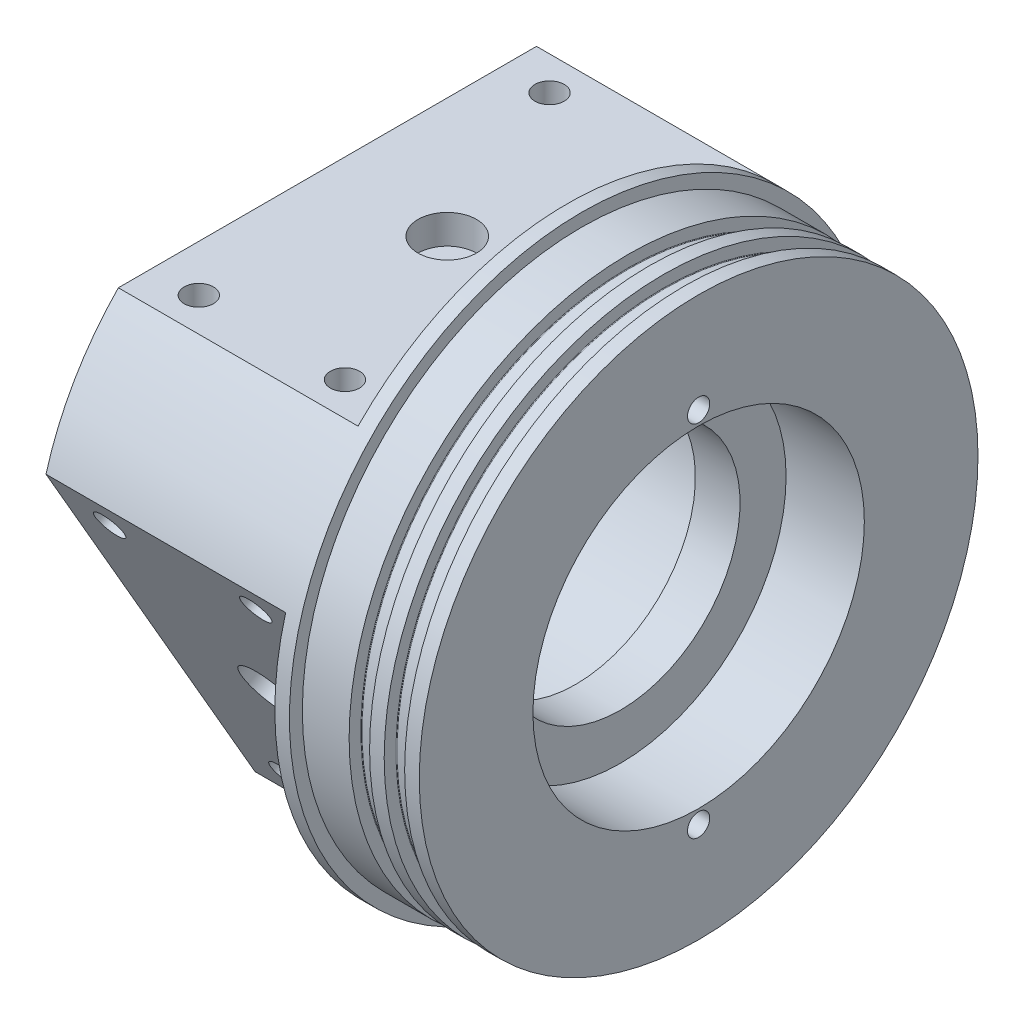
from build123d import *

# Parameters (mm, degrees)
CUT_EXTRUDE2_DEPTH               = 19.05
F_6_32_TAPPED_HOLE2_AT_2_COUNT   = 2
F_6_32_TAPPED_HOLE2_AT_2_PITCH   = 48.360159222
F_6_32_TAPPED_HOLE2_AT_3_COUNT   = 2
F_6_32_TAPPED_HOLE2_AT_3_PITCH   = 44.45
F_6_32_TAPPED_HOLE2_AT_4_COUNT   = 2
F_6_32_TAPPED_HOLE2_AT_4_PITCH   = 19.05
CIRPATTERN4_COUNT                = 3
FILLET1_R                        = 0.127
SKETCH26_R                       = 60.6933
CUT_EXTRUDE8_DEPTH               = 15.24
FILLET2_R                        = 3.175
FILLET3_R                        = 3.175
FILLET4_R                        = 3.175
SKETCH37_R                       = 36
CUT_EXTRUDE11_DEPTH              = 17
CUT_EXTRUDE12_REACH              = 122.275
SKETCH38_R                       = 26
CUT_EXTRUDE13_START              = -53.31
SKETCH39_R                       = 36
CUT_EXTRUDE13_DEPTH              = 53.31
BOSS_EXTRUDE1_DEPTH              = 0.635
BOSS_EXTRUDE1_DEPTH_BACK         = 51.435
SKETCH53_R                       = 63.5
SKETCH53_R_2                     = 36
CUT_EXTRUDE17_DEPTH              = 52.07
SKETCH55_R                       = 6.35
CUT_EXTRUDE18_DEPTH              = 6.35
F_1_4_20_TAPPED_HOLE2_AT_2_COUNT = 2
F_1_4_20_TAPPED_HOLE2_AT_2_PITCH = 31.75
F_1_4_20_TAPPED_HOLE2_AT_3_COUNT = 2
F_1_4_20_TAPPED_HOLE2_AT_3_PITCH = 82.55
F_1_4_20_TAPPED_HOLE2_AT_4_COUNT = 2
F_1_4_20_TAPPED_HOLE2_AT_4_PITCH = 76.2
CIRPATTERN6_COUNT                = 3
CHAMFER1_SIZE                    = 1.27
CHAMFER1_SIZE2                   = 0.733234842
F_10_24_TAPPED_HOLE1_D           = 3.7973
F_10_24_TAPPED_HOLE1_DEPTH       = 12.7
F_10_24_TAPPED_HOLE1_CBORE_D     = 4.826
F_10_24_TAPPED_HOLE1_CBORE_DEPTH = 9.652
F_10_24_TAPPED_HOLE1_TIP         = 1.140824014


with BuildPart() as part:
    # Sketch4 → Revolve1 (revolve)
    with BuildSketch(Plane.XY, mode=Mode.PRIVATE) as revolve1_sk:
        Polygon((0, 0), (0, 63.5), (22.225, 63.5), (22.225, 60.6933), (32.385, 60.6933), (32.385, 58.0136), (36.83, 58.0136), (36.83, 60.6933), (40.005, 60.6933), (40.005, 58.0136), (44.45, 58.0136), (44.45, 60.6933), (47.625, 60.6933), (47.625, 0), align=None)
    revolve(revolve1_sk.sketch.rotate(Axis((0, 0, 0), (1, 0, 0)), 180), axis=Axis((0, 0, 0), (1, 0, 0)))

    # Mirror2: part across plane


with BuildPart() as part_1:
    add(part.part)
    add(part.part.mirror(Plane(origin=(0, 0, 0), x_dir=(0, 0, 1), z_dir=(1, 0, 0))))

    # Sketch8 → Cut-Extrude2 (cut, symmetric)
    with BuildSketch(Plane(origin=(0, 0, 0), x_dir=(0, 0, -1), z_dir=(1, 0, 0))):
        with BuildLine():
            Line((-31.75, 48.64261314), (31.75, 48.64261314))
            Line((31.75, 48.64261314), (31.75, 54.99261314))
            ThreePointArc((31.75, 54.99261314), (0, 63.5), (-31.75, 54.99261314))
            Line((-31.75, 54.99261314), (-31.75, 48.64261314))
        make_face()
    cut_extrude2 = extrude(amount=CUT_EXTRUDE2_DEPTH, both=True, mode=Mode.SUBTRACT)

    # Sketch33 → #6-32 Tapped Hole2 (revolve, cut)
    with BuildSketch(Plane(origin=(-9.525, 48.64261314, -22.225), x_dir=(0, 0, 1), z_dir=(1, 0, 0))):
        Polygon((0, 0), (0, 8.81269403), (1.35255, 8), (1.35255, 5.588), (1.7526, 5.588), (1.7526, 0), align=None)
    f_6_32_tapped_hole2 = revolve(axis=Axis((-9.525, 54.99261314, -22.225), (0, -1, 0)), mode=Mode.SUBTRACT)

    # #6-32 Tapped Hole2 at 2: #6-32 Tapped Hole2 ×2
    with Locations(*[Vector(0.3939192985791678, 0, 0.9191450300180579) * (i * F_6_32_TAPPED_HOLE2_AT_2_PITCH) for i in range(1, F_6_32_TAPPED_HOLE2_AT_2_COUNT)]):
        add(f_6_32_tapped_hole2, mode=Mode.SUBTRACT)

    # #6-32 Tapped Hole2 at 3: #6-32 Tapped Hole2 ×2
    with Locations(*[(0, 0, i * F_6_32_TAPPED_HOLE2_AT_3_PITCH) for i in range(1, F_6_32_TAPPED_HOLE2_AT_3_COUNT)]):
        add(f_6_32_tapped_hole2, mode=Mode.SUBTRACT)

    # #6-32 Tapped Hole2 at 4: #6-32 Tapped Hole2 ×2
    with Locations(*[(i * F_6_32_TAPPED_HOLE2_AT_4_PITCH, 0, 0) for i in range(1, F_6_32_TAPPED_HOLE2_AT_4_COUNT)]):
        add(f_6_32_tapped_hole2, mode=Mode.SUBTRACT)

    # CirPattern4: Cut-Extrude2, #6-32 Tapped Hole2 ×3 about axis
    cirpattern4_axis = Axis((0, 0, 0), (1, 0, 0))
    add([cut_extrude2.rotate(cirpattern4_axis, i * 360 / CIRPATTERN4_COUNT) for i in range(1, CIRPATTERN4_COUNT)], mode=Mode.SUBTRACT)
    add([f_6_32_tapped_hole2.rotate(cirpattern4_axis, i * 360 / CIRPATTERN4_COUNT) for i in range(1, CIRPATTERN4_COUNT)], mode=Mode.SUBTRACT)

    # CirPattern4 copy 1 sketch → CirPattern4 copy 1 (revolve, cut)
    with BuildSketch(Plane(origin=(9.525, -43.568721169, 31.013238686), x_dir=(0, -0.8660254037844386, -0.49999999999999994), z_dir=(1, 0, 0))):
        Polygon((0, 0), (0, 8.81269403), (1.35255, 8), (1.35255, 5.588), (1.7526, 5.588), (1.7526, 0), align=None)
    revolve(axis=Axis((9.525, -46.743721169, 36.5125), (0, 0.49999999999999994, -0.8660254037844386)), mode=Mode.SUBTRACT)

    # CirPattern4 copy 2 sketch → CirPattern4 copy 2 (revolve, cut)
    with BuildSketch(Plane(origin=(9.525, -5.073891971, -53.238238686), x_dir=(0, 0.8660254037844385, -0.5000000000000002), z_dir=(1, 0, 0))):
        Polygon((0, 0), (0, 8.81269403), (1.35255, 8), (1.35255, 5.588), (1.7526, 5.588), (1.7526, 0), align=None)
    revolve(axis=Axis((9.525, -8.248891971, -58.7375), (0, 0.5000000000000002, 0.8660254037844385)), mode=Mode.SUBTRACT)

    # CirPattern4 copy 3 sketch → CirPattern4 copy 3 (revolve, cut)
    with BuildSketch(Plane(origin=(-9.525, -43.568721169, 31.013238686), x_dir=(0, -0.8660254037844386, -0.49999999999999994), z_dir=(1, 0, 0))):
        Polygon((0, 0), (0, 8.81269403), (1.35255, 8), (1.35255, 5.588), (1.7526, 5.588), (1.7526, 0), align=None)
    revolve(axis=Axis((-9.525, -46.743721169, 36.5125), (0, 0.49999999999999994, -0.8660254037844386)), mode=Mode.SUBTRACT)

    # CirPattern4 copy 4 sketch → CirPattern4 copy 4 (revolve, cut)
    with BuildSketch(Plane(origin=(-9.525, -5.073891971, -53.238238686), x_dir=(0, 0.8660254037844385, -0.5000000000000002), z_dir=(1, 0, 0))):
        Polygon((0, 0), (0, 8.81269403), (1.35255, 8), (1.35255, 5.588), (1.7526, 5.588), (1.7526, 0), align=None)
    revolve(axis=Axis((-9.525, -8.248891971, -58.7375), (0, 0.5000000000000002, 0.8660254037844385)), mode=Mode.SUBTRACT)

    # CirPattern4 copy 5 sketch → CirPattern4 copy 5 (revolve, cut)
    with BuildSketch(Plane(origin=(9.525, -5.073891971, 53.238238686), x_dir=(0, -0.8660254037844386, -0.49999999999999994), z_dir=(1, 0, 0))):
        Polygon((0, 0), (0, 8.81269403), (1.35255, 8), (1.35255, 5.588), (1.7526, 5.588), (1.7526, 0), align=None)
    revolve(axis=Axis((9.525, -8.248891971, 58.7375), (0, 0.49999999999999994, -0.8660254037844386)), mode=Mode.SUBTRACT)

    # CirPattern4 copy 6 sketch → CirPattern4 copy 6 (revolve, cut)
    with BuildSketch(Plane(origin=(9.525, -43.568721169, -31.013238686), x_dir=(0, 0.8660254037844385, -0.5000000000000002), z_dir=(1, 0, 0))):
        Polygon((0, 0), (0, 8.81269403), (1.35255, 8), (1.35255, 5.588), (1.7526, 5.588), (1.7526, 0), align=None)
    revolve(axis=Axis((9.525, -46.743721169, -36.5125), (0, 0.5000000000000002, 0.8660254037844385)), mode=Mode.SUBTRACT)

    # Fillet1
    fillet1_edges = [part_1.edges().sort_by_distance(p)[0] for p in [
        (44.45, 58.0136, 0),
        (40.005, 58.0136, 0),
        (36.83, 58.0136, 0),
        (32.385, 58.0136, 0),
    ]]
    fillet(fillet1_edges, radius=FILLET1_R)

    # Sketch26 → Cut-Extrude8 (cut)
    with BuildSketch(Plane.ZY.offset(47.625)):
        with Locations(Location((0, 0, 0), (0, 0, 270))):
            Circle(SKETCH26_R)
    extrude(amount=-CUT_EXTRUDE8_DEPTH, mode=Mode.SUBTRACT)

    # Fillet2
    fillet2_edges = [part_1.edges().sort_by_distance(p)[0] for p in [
        (-19.05, 1.5875, 60.750369343),
    ]]
    fillet(fillet2_edges, radius=FILLET2_R)

    # Fillet3
    fillet3_edges = [part_1.edges().sort_by_distance(p)[0] for p in [
        (19.05, 1.5875, 60.750369343),
    ]]
    fillet(fillet3_edges, radius=FILLET3_R)

    # Fillet4
    fillet4_edges = [part_1.edges().sort_by_distance(p)[0] for p in [
        (-19.05, 1.5875, -60.750369343),
        (-19.05, -53.40511314, -29.000369343),
        (19.05, 1.5875, -60.750369343),
        (19.05, -53.40511314, -29.000369343),
        (-19.05, 51.81761314, 31.75),
        (-19.05, 51.81761314, -31.75),
        (19.05, 51.81761314, 31.75),
        (19.05, 51.81761314, -31.75),
        (-19.05, -53.40511314, 29.000369343),
        (19.05, -53.40511314, 29.000369343),
    ]]
    fillet(fillet4_edges, radius=FILLET4_R)

    # Sketch37 → Cut-Extrude11 (cut)
    with BuildSketch(Plane(origin=(47.625, 0, 0), x_dir=(0, 0, -1), z_dir=(1, 0, 0))):
        with Locations(Location((0, 0, 0), (0, 0, 90))):
            Circle(SKETCH37_R)
    extrude(amount=-CUT_EXTRUDE11_DEPTH, mode=Mode.SUBTRACT)

    # Sketch38 → Cut-Extrude12 (cut, up to next)
    with BuildSketch(Plane.ZY.offset(32.385), mode=Mode.PRIVATE) as cut_extrude12_sk1:
        with Locations(Location((0, 0, 0), (0, 0, 270))):
            Circle(SKETCH38_R)
    cut_extrude12_tool1 = extrude(cut_extrude12_sk1.sketch, amount=-CUT_EXTRUDE12_REACH, mode=Mode.PRIVATE) & part_1.part
    add(cut_extrude12_tool1.solids().sort_by_distance((-32.385, 0, 0))[0], mode=Mode.SUBTRACT)

    # Sketch39 → Cut-Extrude13 (cut)
    with BuildSketch(Plane.ZY.offset(32.385).offset(CUT_EXTRUDE13_START)):
        with Locations(Location((0, 0, 0), (0, 0, 90))):
            Circle(SKETCH39_R)
    extrude(amount=CUT_EXTRUDE13_DEPTH, mode=Mode.SUBTRACT)

    # Sketch53 → Boss-Extrude1 (add, two sides: drawn at the far end of the back side and taken through both)
    with BuildSketch(Plane.ZY.offset(32.385).offset(-BOSS_EXTRUDE1_DEPTH_BACK)):
        with Locations(Location((0, 0, 0), (0, 0, 270))):
            Circle(SKETCH53_R)
        with Locations(Location((0, 0, 0), (0, 0, 90))):
            Circle(SKETCH53_R_2, mode=Mode.SUBTRACT)
    extrude(amount=BOSS_EXTRUDE1_DEPTH + BOSS_EXTRUDE1_DEPTH_BACK)

    # Sketch54 → Cut-Extrude17 (cut)
    with BuildSketch(Plane.ZY.offset(33.02)):
        with BuildLine():
            Line((-45.422636136, 44.3738), (45.422636136, 44.3738))
            ThreePointArc((45.422636136, 44.3738), (0, 63.5), (-45.422636136, 44.3738))
        make_face()
    cut_extrude17 = extrude(amount=-CUT_EXTRUDE17_DEPTH, mode=Mode.SUBTRACT)

    # Sketch55 → Cut-Extrude18 (cut)
    with BuildSketch(Plane(origin=(0, 44.3738, 0), x_dir=(1, 0, 0), z_dir=(0, 1, 0))):
        with Locations(Location((-6.985, 0, 0), (0, 0, 180))):
            Circle(SKETCH55_R)
    cut_extrude18 = extrude(amount=-CUT_EXTRUDE18_DEPTH, mode=Mode.SUBTRACT)

    # Sketch60 → 1/4-20 Tapped Hole2 (revolve, cut)
    with BuildSketch(Plane(origin=(-22.86, 44.3738, -38.1), x_dir=(0, 0, 1), z_dir=(1, 0, 0))):
        Polygon((0, 0), (0, 20.583816902), (2.5527, 19.05), (2.5527, 12.7), (3.175, 12.7), (3.175, 0), align=None)
    f_1_4_20_tapped_hole2 = revolve(axis=Axis((-22.86, 50.7238, -38.1), (0, -1, 0)), mode=Mode.SUBTRACT)

    # 1/4-20 Tapped Hole2 at 2: 1/4-20 Tapped Hole2 ×2
    with Locations(*[(i * F_1_4_20_TAPPED_HOLE2_AT_2_PITCH, 0, 0) for i in range(1, F_1_4_20_TAPPED_HOLE2_AT_2_COUNT)]):
        add(f_1_4_20_tapped_hole2, mode=Mode.SUBTRACT)

    # 1/4-20 Tapped Hole2 at 3: 1/4-20 Tapped Hole2 ×2
    with Locations(*[Vector(0.38461538461538486, 0, 0.923076923076923) * (i * F_1_4_20_TAPPED_HOLE2_AT_3_PITCH) for i in range(1, F_1_4_20_TAPPED_HOLE2_AT_3_COUNT)]):
        add(f_1_4_20_tapped_hole2, mode=Mode.SUBTRACT)

    # 1/4-20 Tapped Hole2 at 4: 1/4-20 Tapped Hole2 ×2
    with Locations(*[(0, 0, i * F_1_4_20_TAPPED_HOLE2_AT_4_PITCH) for i in range(1, F_1_4_20_TAPPED_HOLE2_AT_4_COUNT)]):
        add(f_1_4_20_tapped_hole2, mode=Mode.SUBTRACT)

    # CirPattern6: Cut-Extrude17, Cut-Extrude18, 1/4-20 Tapped Hole2 ×3 about axis
    cirpattern6_axis = Axis((0, 0, 0), (1, 0, 0))
    add([cut_extrude17.rotate(cirpattern6_axis, i * 360 / CIRPATTERN6_COUNT) for i in range(1, CIRPATTERN6_COUNT)], mode=Mode.SUBTRACT)
    add([cut_extrude18.rotate(cirpattern6_axis, i * 360 / CIRPATTERN6_COUNT) for i in range(1, CIRPATTERN6_COUNT)], mode=Mode.SUBTRACT)
    add([f_1_4_20_tapped_hole2.rotate(cirpattern6_axis, i * 360 / CIRPATTERN6_COUNT) for i in range(1, CIRPATTERN6_COUNT)], mode=Mode.SUBTRACT)

    # CirPattern6 copy 1 sketch → CirPattern6 copy 1 (revolve, cut)
    with BuildSketch(Plane(origin=(8.89, 10.808667884, 57.478838062), x_dir=(0, -0.8660254037844387, -0.4999999999999998), z_dir=(1, 0, 0))):
        Polygon((0, 0), (0, 20.583816902), (2.5527, 19.05), (2.5527, 12.7), (3.175, 12.7), (3.175, 0), align=None)
    revolve(axis=Axis((8.89, 7.633667884, 62.978099376), (0, 0.4999999999999998, -0.8660254037844387)), mode=Mode.SUBTRACT)

    # CirPattern6 copy 2 sketch → CirPattern6 copy 2 (revolve, cut)
    with BuildSketch(Plane(origin=(8.89, -55.182467884, -19.378838062), x_dir=(0, 0.8660254037844384, -0.5000000000000004), z_dir=(1, 0, 0))):
        Polygon((0, 0), (0, 20.583816902), (2.5527, 19.05), (2.5527, 12.7), (3.175, 12.7), (3.175, 0), align=None)
    revolve(axis=Axis((8.89, -58.357467884, -24.878099376), (0, 0.5000000000000004, 0.8660254037844384)), mode=Mode.SUBTRACT)

    # CirPattern6 copy 3 sketch → CirPattern6 copy 3 (revolve, cut)
    with BuildSketch(Plane(origin=(8.89, -55.182467884, 19.378838062), x_dir=(0, -0.8660254037844387, -0.4999999999999998), z_dir=(1, 0, 0))):
        Polygon((0, 0), (0, 20.583816902), (2.5527, 19.05), (2.5527, 12.7), (3.175, 12.7), (3.175, 0), align=None)
    revolve(axis=Axis((8.89, -58.357467884, 24.878099376), (0, 0.4999999999999998, -0.8660254037844387)), mode=Mode.SUBTRACT)

    # CirPattern6 copy 4 sketch → CirPattern6 copy 4 (revolve, cut)
    with BuildSketch(Plane(origin=(8.89, 10.808667884, -57.478838062), x_dir=(0, 0.8660254037844384, -0.5000000000000004), z_dir=(1, 0, 0))):
        Polygon((0, 0), (0, 20.583816902), (2.5527, 19.05), (2.5527, 12.7), (3.175, 12.7), (3.175, 0), align=None)
    revolve(axis=Axis((8.89, 7.633667884, -62.978099376), (0, 0.5000000000000004, 0.8660254037844384)), mode=Mode.SUBTRACT)

    # CirPattern6 copy 5 sketch → CirPattern6 copy 5 (revolve, cut)
    with BuildSketch(Plane(origin=(-22.86, -55.182467884, 19.378838062), x_dir=(0, -0.8660254037844387, -0.4999999999999998), z_dir=(1, 0, 0))):
        Polygon((0, 0), (0, 20.583816902), (2.5527, 19.05), (2.5527, 12.7), (3.175, 12.7), (3.175, 0), align=None)
    revolve(axis=Axis((-22.86, -58.357467884, 24.878099376), (0, 0.4999999999999998, -0.8660254037844387)), mode=Mode.SUBTRACT)

    # CirPattern6 copy 6 sketch → CirPattern6 copy 6 (revolve, cut)
    with BuildSketch(Plane(origin=(-22.86, 10.808667884, -57.478838062), x_dir=(0, 0.8660254037844384, -0.5000000000000004), z_dir=(1, 0, 0))):
        Polygon((0, 0), (0, 20.583816902), (2.5527, 19.05), (2.5527, 12.7), (3.175, 12.7), (3.175, 0), align=None)
    revolve(axis=Axis((-22.86, 7.633667884, -62.978099376), (0, 0.5000000000000004, 0.8660254037844384)), mode=Mode.SUBTRACT)

    # Chamfer1
    chamfer1_edges = [part_1.edges().sort_by_distance(p)[0] for p in [
        (-33.02, -36, 0),
    ]]
    chamfer1_side = [part_1.faces().sort_by_distance(p)[0] for p in [
        (-33.02, 42.74317952, 0),
    ]]
    chamfer(chamfer1_edges, length=CHAMFER1_SIZE, length2=CHAMFER1_SIZE2, reference=chamfer1_side[0])

    # #10-24 Tapped Hole1
    with Locations(Plane(origin=(47.625, 39, 0), x_dir=(0, 1, 0), z_dir=(1, 0, 0))):
        with Locations((0, 0), (-78, 0)):
            CounterBoreHole(F_10_24_TAPPED_HOLE1_D / 2, F_10_24_TAPPED_HOLE1_CBORE_D / 2, F_10_24_TAPPED_HOLE1_CBORE_DEPTH, depth=F_10_24_TAPPED_HOLE1_DEPTH)
            with Locations((0, 0, -(F_10_24_TAPPED_HOLE1_DEPTH + F_10_24_TAPPED_HOLE1_TIP / 2))):  # 118° drill point
                Cone(0, F_10_24_TAPPED_HOLE1_D / 2, F_10_24_TAPPED_HOLE1_TIP, mode=Mode.SUBTRACT)


solid = part_1.part
